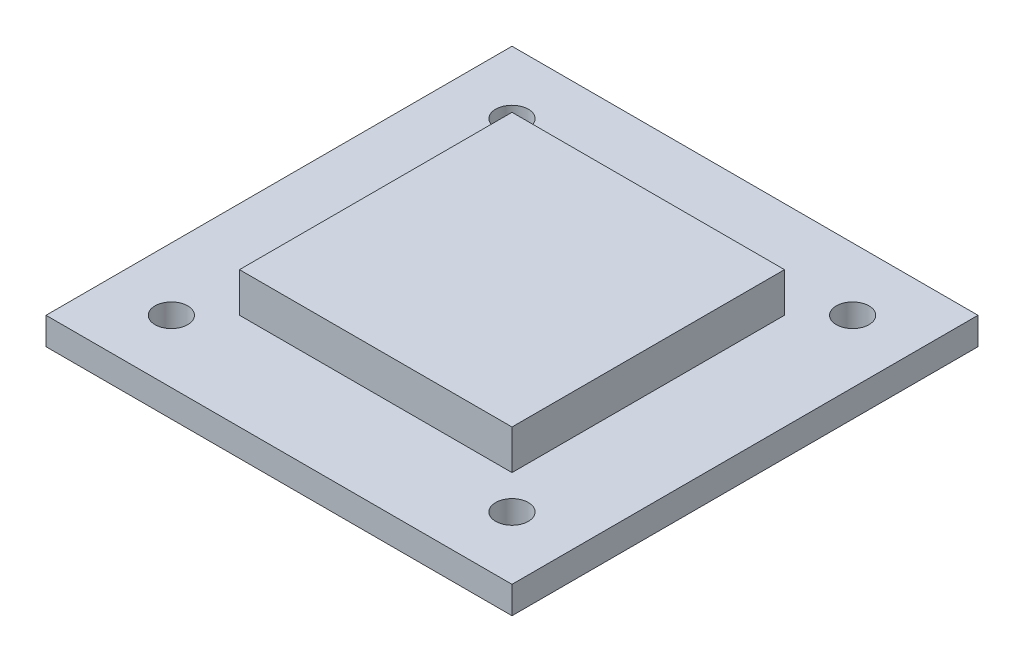
from build123d import *

# Parameters (mm, degrees)
SKETCH1_W            = 34.2
SKETCH1_H            = 34.2
BOSS_EXTRUDE1_DEPTH  = 3.9
M2_CLEARANCE_HOLE1_D = 2.4
CUT_EXTRUDE1_START   = -2.9
SKETCH9_W            = 34.2
SKETCH9_H            = 34.2
SKETCH9_R            = 1.2
SKETCH9_W_2          = 20
SKETCH9_H_2          = 20
CUT_EXTRUDE1_DEPTH   = 2.9


with BuildPart() as part:
    # Sketch1 → Boss-Extrude1 (new, symmetric)
    with BuildSketch(Plane(origin=(0, 0, 0), x_dir=(1, 0, 0), z_dir=(0, 1, 0))):
        Rectangle(SKETCH1_W, SKETCH1_H)
    extrude(amount=BOSS_EXTRUDE1_DEPTH, both=True)

    # M2 Clearance Hole1 (through all)
    with Locations(Plane(origin=(0, 3.9, 0), x_dir=(1, 0, 0), z_dir=(0, 1, 0))):
        with Locations((-12.5, 12.5), (12.5, -12.5), (12.5, 12.5), (-12.5, -12.5)):
            Hole(M2_CLEARANCE_HOLE1_D / 2)

    # Sketch9 → Cut-Extrude1 (cut)
    with BuildSketch(Plane(origin=(0, 3.9, 0), x_dir=(1, 0, 0), z_dir=(0, 1, 0)).offset(CUT_EXTRUDE1_START)):
        Rectangle(SKETCH9_W, SKETCH9_H)
        with Locations(Location((12.5, -12.5, 0), (0, 0, 270))):
            Circle(SKETCH9_R, mode=Mode.SUBTRACT)
        with Locations(Location((-12.5, -12.5, 0), (0, 0, 270))):
            Circle(SKETCH9_R, mode=Mode.SUBTRACT)
        with Locations(Location((12.5, 12.5, 0), (0, 0, 270))):
            Circle(SKETCH9_R, mode=Mode.SUBTRACT)
        with Locations(Location((-12.5, 12.5, 0), (0, 0, 270))):
            Circle(SKETCH9_R, mode=Mode.SUBTRACT)
        Rectangle(SKETCH9_W_2, SKETCH9_H_2, mode=Mode.SUBTRACT)
    cut_extrude1 = extrude(amount=CUT_EXTRUDE1_DEPTH, mode=Mode.SUBTRACT)

    # Mirror1: Cut-Extrude1 across plane
    add(cut_extrude1.mirror(Plane.ZX), mode=Mode.SUBTRACT)


solid = part.part
